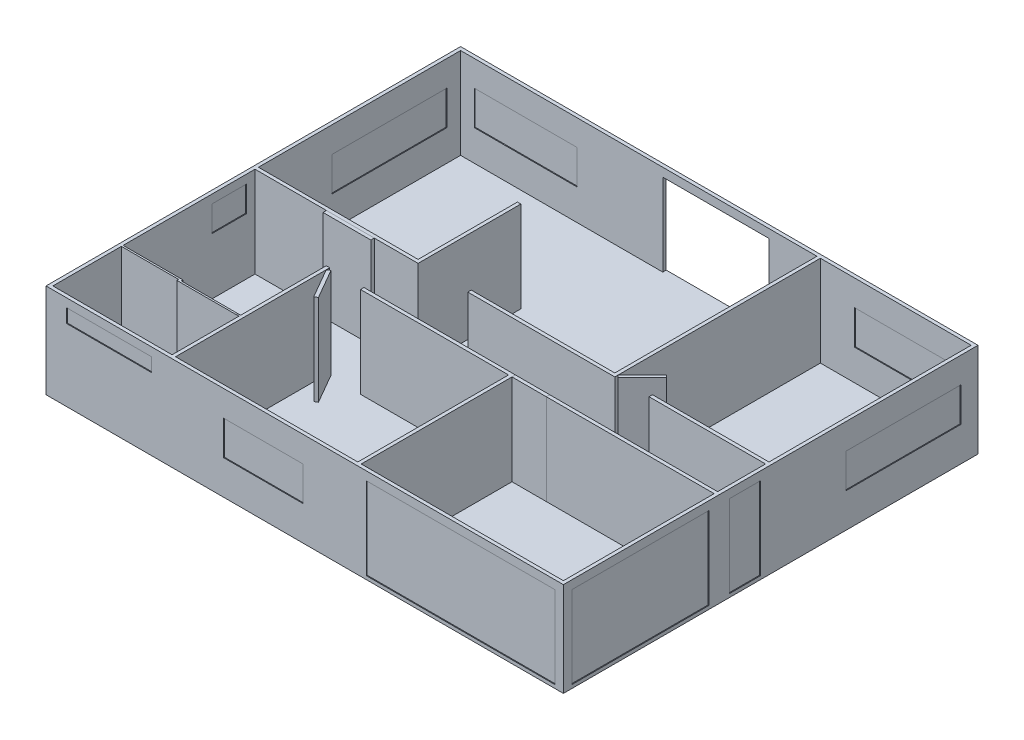
from build123d import *

# Parameters (mm, degrees)
BOSS_EXTRUDE1_DEPTH    = 100
SKETCH1_7_W            = 15100
SKETCH1_7_H            = 12100
BOSS_EXTRUDE2_DEPTH    = 2750
SKETCH2_W              = 900
SKETCH2_H              = 2400
CUT_EXTRUDE1_DEPTH     = 100
SKETCH3_W              = 3100
SKETCH3_H              = 2400
CUT_EXTRUDE2_DEPTH     = 200
SKETCH4_W              = 3000
SKETCH4_H              = 1000
CUT_EXTRUDE3_DEPTH     = 250
SKETCH5_W              = 3000
SKETCH5_H              = 1000
CUT_EXTRUDE4_DEPTH     = 250
SKETCH6_W              = 4000
SKETCH6_H              = 2400
SKETCH6_W_2            = 3350
SKETCH6_H_2            = 1000
CUT_EXTRUDE5_DEPTH     = 250
SKETCH7_W              = 5500
SKETCH7_H              = 2400
SKETCH7_W_2            = 2319.600826821
SKETCH7_H_2            = 1000
SKETCH7_W_3            = 2480.399173179
SKETCH7_H_3            = 400
CUT_EXTRUDE6_DEPTH     = 250
SKETCH9_W              = 3350
SKETCH9_H              = 1000
SKETCH9_W_2            = 1000
SKETCH9_H_2            = 750
CUT_EXTRUDE7_DEPTH     = 250
SKETCH10_W             = 5500
SKETCH10_H             = 2400
SKETCH10_W_2           = 2319.600826821
SKETCH10_H_2           = 1000
SKETCH10_W_3           = 2480.399173179
SKETCH10_H_3           = 400
BOSS_EXTRUDE3_DEPTH    = 75
SKETCH10_3_W           = 5500
SKETCH10_3_H           = 2400
SKETCH10_3_W_2         = 2319.600826821
SKETCH10_3_H_2         = 1000
SKETCH10_3_W_3         = 2480.399173179
SKETCH10_3_H_3         = 400
CUT_EXTRUDE8_DEPTH     = 25
BOSS_EXTRUDE4_START    = -25
SKETCH11_W             = 3350
SKETCH11_H             = 1000
SKETCH11_W_2           = 4000
SKETCH11_H_2           = 2400
SKETCH11_W_3           = 900
BOSS_EXTRUDE4_DEPTH    = 50
BOSS_EXTRUDE5_START    = -25
SKETCH12_W             = 1000
SKETCH12_H             = 750
SKETCH12_W_2           = 3350
SKETCH12_H_2           = 1000
BOSS_EXTRUDE5_DEPTH    = 50
BOSS_EXTRUDE6_START    = -25
SKETCH13_W             = 3000
SKETCH13_H             = 1000
BOSS_EXTRUDE6_DEPTH    = 50
BOSS_EXTRUDE9_DEPTH    = 2650
BOSS_EXTRUDE9_2_DEPTH  = 2650
SKETCH14_W             = 1000
SKETCH14_H             = 100
BOSS_EXTRUDE9_3_DEPTH  = 2650
SKETCH14_W_2           = 1396.20651688
BOSS_EXTRUDE9_4_DEPTH  = 2650
BOSS_EXTRUDE10_DEPTH   = 2650
SKETCH16_W             = 100
SKETCH16_H             = 50
BOSS_EXTRUDE12_DEPTH   = 2650
BOSS_EXTRUDE12_2_DEPTH = 2650


with BuildPart() as part:
    # Sketch1 → Boss-Extrude1 (new body)
    with BuildSketch(Plane(origin=(0, 0, 0), x_dir=(1, 0, 0), z_dir=(0, 1, 0))):
        Polygon((7956.380744076, -1854.743434777), (7956.380744076, -454.743434777), (4556.380744076, -454.743434777), (4556.380744076, -354.743434776), (7956.380744076, -354.743434776), (7956.380744076, 5545.256565223), (3556.380744076, 5545.139320681), (3556.380744076, -454.743434776), (-734.703091916, -454.743434776), (-734.703091916, -354.743434777), (3456.380744076, -354.743434777), (3456.380744076, 5545.136656033), (-2184.783043673, 5544.986338836), (-6943.619255924, 5544.85953257), (-6943.619255924, -354.743434777), (-2284.703091916, -354.743434777), (-2284.703091916, 2544.986339901), (-2184.703104212, 2544.986339901), (-2184.703104212, -454.743434777), (-6943.619255924, -454.743434777), (-6943.619255924, -6354.743434777), (-3463.220082745, -6354.743434777), (-3463.220082745, -1854.743434777), (-3363.220082745, -1854.743434777), (-3363.220082745, -6354.743434777), (1956.380744076, -6354.743434777), (1956.380744076, -1954.743434777), (-2363.220082745, -1954.743434777), (-2363.220082745, -1854.743434777), (2056.380744076, -1854.743434777), (2056.380744076, -6354.743434777), (7956.380744076, -6354.743434777), (7956.380744076, -1954.743434777), (3056.380744076, -1954.743434777), (3056.380744076, -1854.743434777), align=None)
    extrude(amount=BOSS_EXTRUDE1_DEPTH)

    # Sketch1<7> → Boss-Extrude2 (add)
    with BuildSketch(Plane(origin=(0, 0, 0), x_dir=(1, 0, 0), z_dir=(0, 1, 0))):
        with Locations((506.380744076, -404.743434777)):
            Rectangle(SKETCH1_7_W, SKETCH1_7_H)
        Polygon((7956.380744076, -454.743434777), (7956.380744076, -1854.743434777), (3056.380744076, -1854.743434777), (3056.380744076, -1954.743434777), (7956.380744076, -1954.743434777), (7956.380744076, -6354.743434777), (2056.380744076, -6354.743434777), (2056.380744076, -1854.743434777), (-2363.220082745, -1854.743434777), (-2363.220082745, -1954.743434777), (1956.380744076, -1954.743434777), (1956.380744076, -6354.743434777), (-3363.220082745, -6354.743434777), (-3363.220082745, -1854.743434777), (-3463.220082745, -1854.743434777), (-3463.220082745, -6354.743434777), (-6943.619255924, -6354.743434777), (-6943.619255924, -454.743434777), (-2184.703104212, -454.743434777), (-2184.703104212, 2544.986339901), (-2284.703091916, 2544.986339901), (-2284.703091916, -354.743434777), (-6943.619255924, -354.743434777), (-6943.619255924, 5544.85953257), (-2184.783043673, 5544.986338836), (3456.380744076, 5545.136656033), (3456.380744076, -354.743434777), (-734.703091916, -354.743434777), (-734.703091916, -454.743434776), (3556.380744076, -454.743434776), (3556.380744076, 5545.139320681), (7956.380744076, 5545.256565223), (7956.380744076, -354.743434776), (4556.380744076, -354.743434776), (4556.380744076, -454.743434777), align=None, mode=Mode.SUBTRACT)
    extrude(amount=BOSS_EXTRUDE2_DEPTH)

    # Sketch2 → Cut-Extrude1 (cut)
    with BuildSketch(Plane(origin=(8056.380744076, 0, 0), x_dir=(0, 0, -1), z_dir=(1, 0, 0))):
        with Locations((-1154.743434777, 1300)):
            Rectangle(SKETCH2_W, SKETCH2_H)
    extrude(amount=-CUT_EXTRUDE1_DEPTH, mode=Mode.SUBTRACT)

    # Sketch3 → Cut-Extrude2 (cut)
    with BuildSketch(Plane(origin=(0, 0, -5645.256565223), x_dir=(-1, 0, 0), z_dir=(0, 0, -1))):
        with Locations((-506.380744076, 1300)):
            Rectangle(SKETCH3_W, SKETCH3_H)
    extrude(amount=-CUT_EXTRUDE2_DEPTH, mode=Mode.SUBTRACT)

    # Sketch4 → Cut-Extrude3 (cut)
    with BuildSketch(Plane(origin=(0, 0, -5645.256565223), x_dir=(-1, 0, 0), z_dir=(0, 0, -1))):
        with Locations((5043.619255924, 1500)):
            Rectangle(SKETCH4_W, SKETCH4_H)
    extrude(amount=-CUT_EXTRUDE3_DEPTH, mode=Mode.SUBTRACT)

    # Sketch5 → Cut-Extrude4 (cut)
    with BuildSketch(Plane(origin=(0, 0, -5645.256565223), x_dir=(-1, 0, 0), z_dir=(0, 0, -1))):
        with Locations((-6056.380744076, 1500)):
            Rectangle(SKETCH5_W, SKETCH5_H)
    extrude(amount=-CUT_EXTRUDE4_DEPTH, mode=Mode.SUBTRACT)

    # Sketch6 → Cut-Extrude5 (cut)
    with BuildSketch(Plane(origin=(8056.380744076, 0, 0), x_dir=(0, 0, -1), z_dir=(1, 0, 0))):
        with Locations((-4204.743434777, 1300)):
            Rectangle(SKETCH6_W, SKETCH6_H)
        with Locations((3470.256565223, 1500)):
            Rectangle(SKETCH6_W_2, SKETCH6_H_2)
    extrude(amount=-CUT_EXTRUDE5_DEPTH, mode=Mode.SUBTRACT)

    # Sketch7 → Cut-Extrude6 (cut)
    with BuildSketch(Plane.XY.offset(6454.743434777)):
        with Locations((5056.380744076, 1300)):
            Rectangle(SKETCH7_W, SKETCH7_H)
        with Locations((-703.419669334, 1500)):
            Rectangle(SKETCH7_W_2, SKETCH7_H_2)
        with Locations((-5203.419669335, 2300)):
            Rectangle(SKETCH7_W_3, SKETCH7_H_3)
    extrude(amount=-CUT_EXTRUDE6_DEPTH, mode=Mode.SUBTRACT)

    # Sketch9 → Cut-Extrude7 (cut)
    with BuildSketch(Plane.ZY.offset(7043.619255924)):
        with Locations((-3470.256565223, 1500)):
            Rectangle(SKETCH9_W, SKETCH9_H)
        with Locations((1204.743434777, 2125)):
            Rectangle(SKETCH9_W_2, SKETCH9_H_2)
    extrude(amount=-CUT_EXTRUDE7_DEPTH, mode=Mode.SUBTRACT)

    # Sketch10 → Boss-Extrude3 (add)
    with BuildSketch(Plane.XY.offset(6454.743434777)):
        with Locations((5056.380744076, 1300)):
            Rectangle(SKETCH10_W, SKETCH10_H)
        with Locations((-703.419669334, 1500)):
            Rectangle(SKETCH10_W_2, SKETCH10_H_2)
        with Locations((-5203.419669335, 2300)):
            Rectangle(SKETCH10_W_3, SKETCH10_H_3)
    extrude(amount=-BOSS_EXTRUDE3_DEPTH)

    # Sketch10<3> → Cut-Extrude8 (cut)
    with BuildSketch(Plane.XY.offset(6454.743434777)):
        with Locations((5056.380744076, 1300)):
            Rectangle(SKETCH10_3_W, SKETCH10_3_H)
        with Locations((-703.419669334, 1500)):
            Rectangle(SKETCH10_3_W_2, SKETCH10_3_H_2)
        with Locations((-5203.419669335, 2300)):
            Rectangle(SKETCH10_3_W_3, SKETCH10_3_H_3)
    extrude(amount=-CUT_EXTRUDE8_DEPTH, mode=Mode.SUBTRACT)

    # Sketch11 → Boss-Extrude4 (add)
    with BuildSketch(Plane(origin=(8056.380744076, 0, 0), x_dir=(0, 0, -1), z_dir=(1, 0, 0)).offset(BOSS_EXTRUDE4_START)):
        with Locations((3470.256565223, 1500)):
            Rectangle(SKETCH11_W, SKETCH11_H)
        with Locations((-4204.743434777, 1300)):
            Rectangle(SKETCH11_W_2, SKETCH11_H_2)
        with Locations((-1154.743434777, 1300)):
            Rectangle(SKETCH11_W_3, SKETCH11_H_2)
    extrude(amount=-BOSS_EXTRUDE4_DEPTH)

    # Sketch12 → Boss-Extrude5 (add)
    with BuildSketch(Plane.ZY.offset(7043.619255924).offset(BOSS_EXTRUDE5_START)):
        with Locations((1204.743434777, 2125)):
            Rectangle(SKETCH12_W, SKETCH12_H)
        with Locations((-3470.256565223, 1500)):
            Rectangle(SKETCH12_W_2, SKETCH12_H_2)
    extrude(amount=-BOSS_EXTRUDE5_DEPTH)

    # Sketch13 → Boss-Extrude6 (add)
    with BuildSketch(Plane(origin=(0, 0, -5645.256565223), x_dir=(-1, 0, 0), z_dir=(0, 0, -1)).offset(BOSS_EXTRUDE6_START)):
        with Locations((-6056.380744076, 1500)):
            Rectangle(SKETCH13_W, SKETCH13_H)
        with Locations((5043.619255924, 1500)):
            Rectangle(SKETCH13_W, SKETCH13_H)
    extrude(amount=-BOSS_EXTRUDE6_DEPTH)

    # Sketch15 → Boss-Extrude10 (add)
    with BuildSketch(Plane(origin=(0, 100, 0), x_dir=(1, 0, 0), z_dir=(0, 1, 0))):
        Polygon((-6943.619255924, -4354.743434777), (-5273.653015998, -4354.743434777), (-5273.653015998, -4404.743434777), (-5193.619255924, -4404.743434777), (-3463.220082745, -4404.743434777), (-3463.220082745, -4354.743434777), (-5193.619255924, -4354.743434777), (-5193.619255924, -4304.743434777), (-6943.619255924, -4304.743434777), align=None)
    extrude(amount=BOSS_EXTRUDE10_DEPTH)


with BuildPart() as body_2:
    # Sketch14 → Boss-Extrude9 (new body)
    with BuildSketch(Plane(origin=(0, 100, 0), x_dir=(1, 0, 0), z_dir=(0, 1, 0))):
        Polygon((-3363.220082745, -1954.743434777), (-3276.617542367, -1904.743434777), (-2776.617542367, -2770.768838561), (-2863.220082745, -2820.768838561), align=None)
    extrude(amount=BOSS_EXTRUDE9_DEPTH)


with BuildPart() as body_3:
    # Sketch14 → Boss-Extrude9 2 (new body)
    with BuildSketch(Plane(origin=(0, 100, 0), x_dir=(1, 0, 0), z_dir=(0, 1, 0))):
        Polygon((3627.091422195, -425.454112895), (3556.380744076, -354.743434776), (4263.487525262, 352.36334641), (4334.198203381, 281.652668291), align=None)
    extrude(amount=BOSS_EXTRUDE9_2_DEPTH)


with BuildPart() as body_4:
    # Sketch14 → Boss-Extrude9 3 (new body)
    with BuildSketch(Plane(origin=(0, 100, 0), x_dir=(1, 0, 0), z_dir=(0, 1, 0))):
        with Locations((2556.380744076, -1904.743434777)):
            Rectangle(SKETCH14_W, SKETCH14_H)
    extrude(amount=BOSS_EXTRUDE9_3_DEPTH)


with BuildPart() as body_5:
    # Sketch14 → Boss-Extrude9 4 (new body)
    with BuildSketch(Plane(origin=(0, 100, 0), x_dir=(1, 0, 0), z_dir=(0, 1, 0))):
        with Locations((-4161.323341185, -504.743434777)):
            Rectangle(SKETCH14_W_2, SKETCH14_H)
    extrude(amount=BOSS_EXTRUDE9_4_DEPTH)


with BuildPart() as body_6:
    # Sketch16 → Boss-Extrude12 (new body)
    with BuildSketch(Plane(origin=(0, 2750, 0), x_dir=(1, 0, 0), z_dir=(0, 1, 0))):
        with Locations((-6893.619255924, -4329.743434777)):
            Rectangle(SKETCH16_W, SKETCH16_H)
    extrude(amount=-BOSS_EXTRUDE12_DEPTH)


with BuildPart() as body_7:
    # Sketch16 → Boss-Extrude12 2 (new body)
    with BuildSketch(Plane(origin=(0, 2750, 0), x_dir=(1, 0, 0), z_dir=(0, 1, 0))):
        with Locations((-3513.220082745, -4379.743434777)):
            Rectangle(SKETCH16_W, SKETCH16_H)
    extrude(amount=-BOSS_EXTRUDE12_2_DEPTH)


solid = Compound([part.part, body_2.part, body_3.part, body_4.part, body_5.part, body_6.part, body_7.part])
